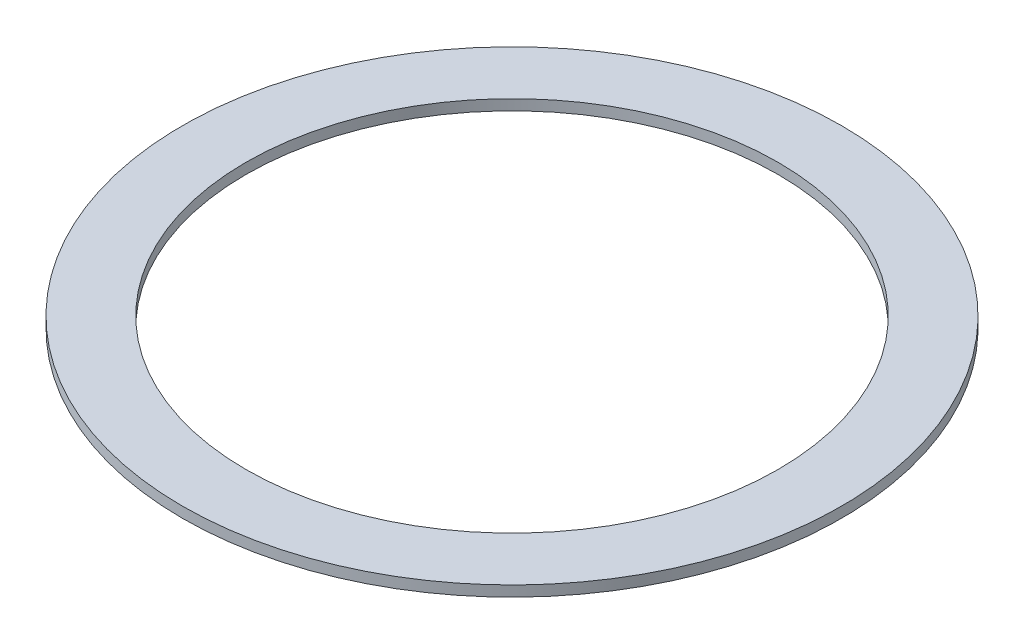
from build123d import *

# Parameters (mm, degrees)
SKETCH1_R           = 7.9121
BOSS_EXTRUDE1_DEPTH = 0.254
SKETCH5_R           = 6.3881
CUT_EXTRUDE1_DEPTH  = 12.192281663


with BuildPart() as part:
    # Sketch1 → Boss-Extrude1 (new body)
    with BuildSketch(Plane(origin=(0, 0, 0), x_dir=(1, 0, 0), z_dir=(0, 1, 0))):
        with Locations(Location((0, 0, 0), (0, 0, 270))):
            Circle(SKETCH1_R)
    extrude(amount=BOSS_EXTRUDE1_DEPTH)

    # Sketch5 → Cut-Extrude1 (cut, through all)
    with BuildSketch(Plane(origin=(0, 0.254, 0), x_dir=(-1, 0, 0), z_dir=(0, 1, 0))):
        with Locations(Location((0, 0, 0), (0, 0, 90))):
            Circle(SKETCH5_R)
    extrude(amount=-CUT_EXTRUDE1_DEPTH, mode=Mode.SUBTRACT)


solid = part.part
